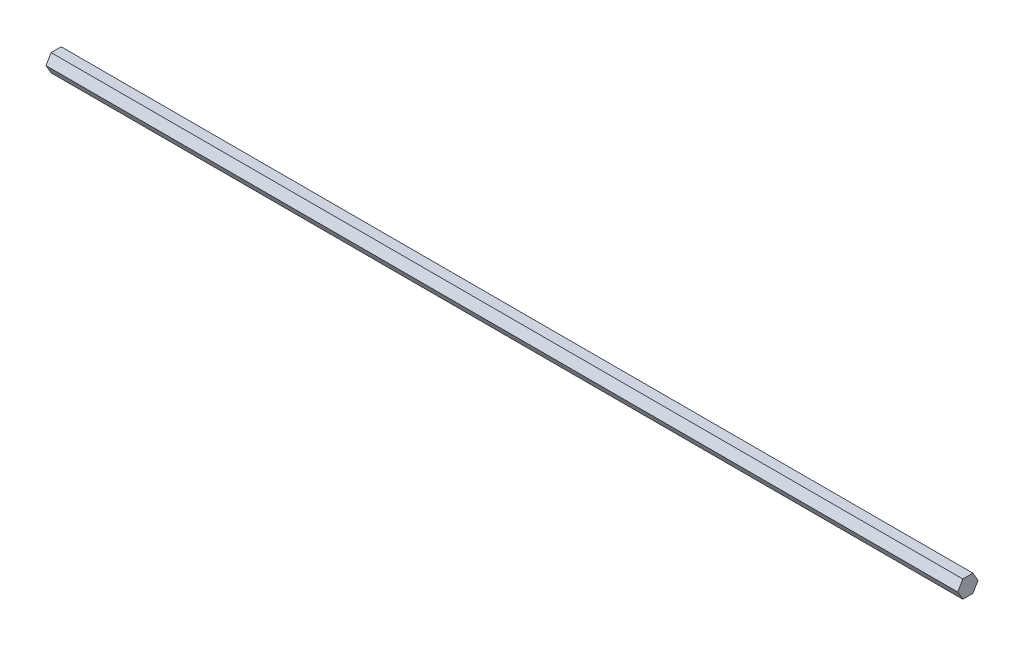
from build123d import *

# Parameters (mm, degrees)
SALIENTE_EXTRUIR1_DEPTH = 660


with BuildPart() as part:
    # Croquis1 → Saliente-Extruir1 (new body)
    with BuildSketch(Plane(origin=(0, 0, 0), x_dir=(0, 0, -1), z_dir=(1, 0, 0))):
        Polygon((7.332348419, 0), (3.666174209, 6.35), (-3.666174209, 6.35), (-7.332348419, 0), (-3.666174209, -6.35), (3.666174209, -6.35), align=None)
    extrude(amount=SALIENTE_EXTRUIR1_DEPTH)


solid = part.part
